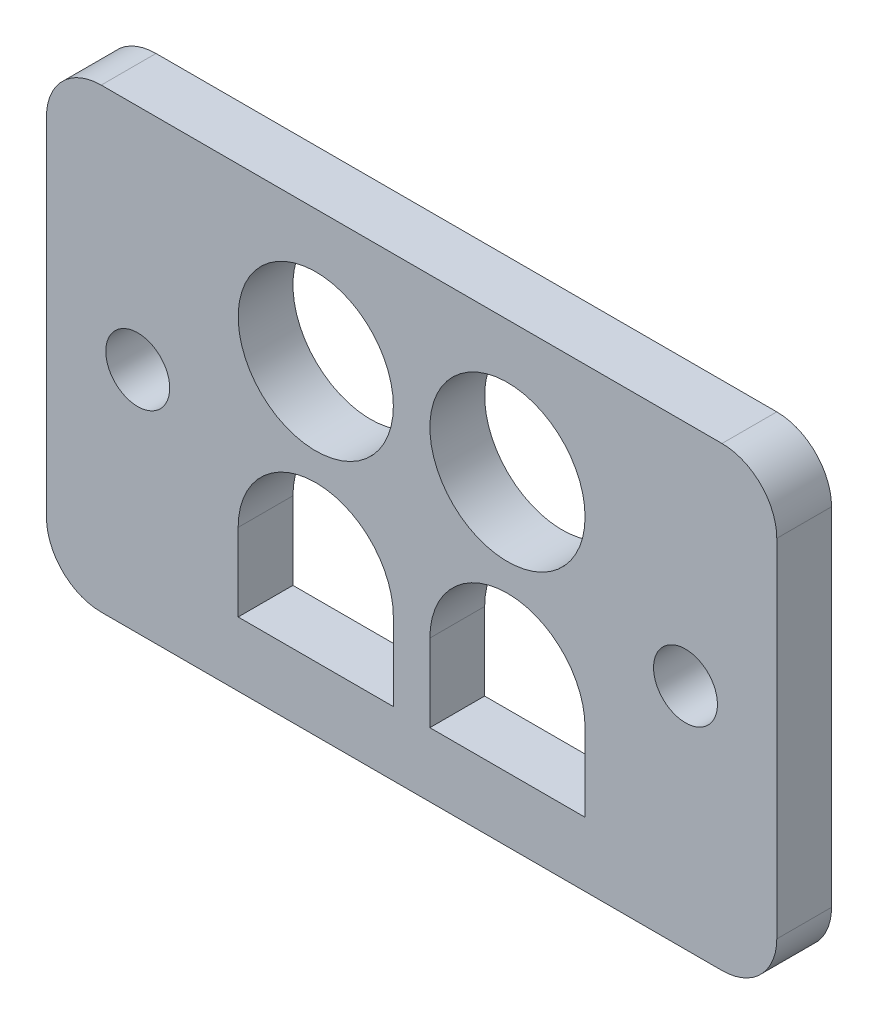
from build123d import *

# Parameters (mm, degrees)
BOSS_EXTRUDE1_DEPTH = 3
SKETCH2_R           = 4.25
CUT_EXTRUDE1_DEPTH  = 3
SKETCH3_R           = 1.75
CUT_EXTRUDE2_DEPTH  = 3


with BuildPart() as part:
    # Sketch1 → Boss-Extrude1 (new body)
    with BuildSketch(Plane.XY):
        with BuildLine():
            Line((-17, 12.5), (17, 12.5))
            ThreePointArc((17, 12.5), (19.121320344, 11.621320344), (20, 9.5))
            Line((20, 9.5), (20, -9.5))
            ThreePointArc((20, -9.5), (19.121320344, -11.621320344), (17, -12.5))
            Line((17, -12.5), (-17, -12.5))
            ThreePointArc((-17, -12.5), (-19.121320344, -11.621320344), (-20, -9.5))
            Line((-20, -9.5), (-20, 9.5))
            ThreePointArc((-20, 9.5), (-19.121320344, 11.621320344), (-17, 12.5))
        make_face()
    extrude(amount=BOSS_EXTRUDE1_DEPTH)

    # Sketch2 → Cut-Extrude1 (cut)
    with BuildSketch(Plane.XY.offset(3)):
        with Locations((-5.25, 5.27)):
            Circle(SKETCH2_R)
        with Locations((5.25, 5.27)):
            Circle(SKETCH2_R)
        with BuildLine():
            Line((-9.5, -4.73), (-9.5, -8.98))
            Line((-9.5, -8.98), (-1, -8.98))
            Line((-1, -8.98), (-1, -4.73))
            ThreePointArc((-1, -4.73), (-5.25, -0.48), (-9.5, -4.73))
        make_face()
        with BuildLine():
            Line((1, -4.73), (1, -8.98))
            Line((1, -8.98), (9.5, -8.98))
            Line((9.5, -8.98), (9.5, -4.73))
            ThreePointArc((9.5, -4.73), (5.25, -0.48), (1, -4.73))
        make_face()
    extrude(amount=-CUT_EXTRUDE1_DEPTH, mode=Mode.SUBTRACT)

    # Sketch3 → Cut-Extrude2 (cut)
    with BuildSketch(Plane.XY.offset(3)):
        with Locations((-15, 0)):
            Circle(SKETCH3_R)
        with Locations((15, 0)):
            Circle(SKETCH3_R)
    extrude(amount=-CUT_EXTRUDE2_DEPTH, mode=Mode.SUBTRACT)


solid = part.part
